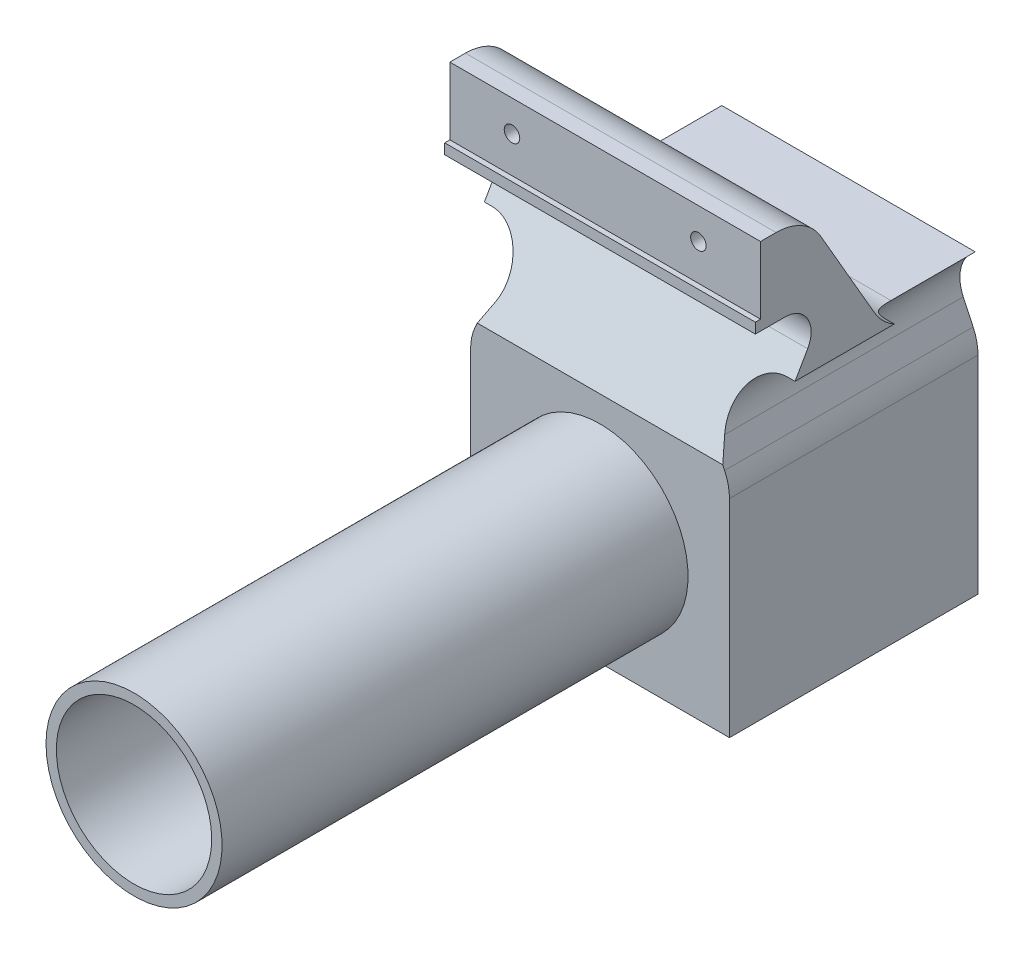
from build123d import *

# Parameters (mm, degrees)
SKETCH2_R               = 2.5
SKETCH2_R_2             = 8
BOSS_EXTRUDE1_DEPTH     = 48
CUT_EXTRUDE1_DEPTH      = 103.122475489
CUT_EXTRUDE1_DEPTH_BACK = 103.122475489
SKETCH3_W               = 1
SKETCH3_H               = 13
CUT_EXTRUDE2_DEPTH      = 103.122475489
CUT_EXTRUDE2_DEPTH_BACK = 103.122475489
SKETCH4_R               = 1.5
CUT_EXTRUDE3_DEPTH      = 5
CUT_EXTRUDE4_START      = -48
SKETCH2_4_R             = 2.5
CUT_EXTRUDE4_DEPTH      = 5
SKETCH6_R               = 17
SKETCH6_R_2             = 15
BOSS_EXTRUDE2_DEPTH     = 90
CUT_EXTRUDE6_START      = -38
SKETCH7_R               = 15
CUT_EXTRUDE6_DEPTH      = 38
CUT_EXTRUDE7_REACH      = 129.377
SKETCH8_R               = 15


with BuildPart() as part:
    # Sketch2 → Boss-Extrude1 (new body)
    # profile 1 of 3: a face of its own
    with BuildSketch(Plane.XY):
        with BuildLine():
            Line((25, 0), (25, 40))
            ThreePointArc((25, 40), (24.762960071, 42.164396139), (24.06307787, 44.226182617))
            Line((24.06307787, 44.226182617), (22.155845491, 48.316255655))
            ThreePointArc((22.155845491, 48.316255655), (22.596259879, 55.035680745), (28.5, 58.274583487))
            Line((28.5, 58.274583487), (30, 58.274583487))
            Line((30, 58.274583487), (30, 85))
            Line((30, 85), (-30, 85))
            Line((-30, 85), (-30, 58.274583487))
            Line((-30, 58.274583487), (-28.5, 58.274583487))
            ThreePointArc((-28.5, 58.274583487), (-22.596259879, 55.035680745), (-22.155845491, 48.316255655))
            Line((-22.155845491, 48.316255655), (-24.06307787, 44.226182617))
            ThreePointArc((-24.06307787, 44.226182617), (-24.762960071, 42.164396139), (-25, 40))
            Line((-25, 40), (-25, 0))
            Line((-25, 0), (25, 0))
        make_face()
        with Locations((15, 23)):
            Circle(SKETCH2_R, mode=Mode.SUBTRACT)
        with Locations((-15, 23)):
            Circle(SKETCH2_R, mode=Mode.SUBTRACT)
        with Locations((0, 23)):
            Circle(SKETCH2_R_2, mode=Mode.SUBTRACT)
    # profile 2 of 3: a face of its own
    with BuildSketch(Plane.XY):
        with Locations((15, 23)):
            Circle(SKETCH2_R)
    # profile 3 of 3: a face of its own
    with BuildSketch(Plane.XY):
        with Locations((-15, 23)):
            Circle(SKETCH2_R)
    extrude(amount=-BOSS_EXTRUDE1_DEPTH)

    # Sketch3 → Cut-Extrude1 (cut, two sides: drawn at the far end of the back side and taken through both)
    with BuildSketch(Plane(origin=(0, 0, 0), x_dir=(0, 0, -1), z_dir=(1, 0, 0)).offset(-CUT_EXTRUDE1_DEPTH_BACK)):
        with Locations((0.5, 78.5)):
            Rectangle(SKETCH3_W, SKETCH3_H)
    extrude(amount=CUT_EXTRUDE1_DEPTH + CUT_EXTRUDE1_DEPTH_BACK, mode=Mode.SUBTRACT)

    # Sketch3<3> → Cut-Extrude2 (cut, two sides: drawn at the far end of the back side and taken through both)
    with BuildSketch(Plane(origin=(0, 0, 0), x_dir=(0, 0, -1), z_dir=(1, 0, 0)).offset(-CUT_EXTRUDE2_DEPTH_BACK)):
        with BuildLine():
            ThreePointArc((12.660254038, 80), (9, 83.660254038), (4, 85))
            Line((4, 85), (48, 85))
            Line((48, 85), (48, 57))
            Line((48, 57), (31.712812921, 57))
            ThreePointArc((31.712812921, 57), (26.712812921, 58.339745962), (23.052558883, 62))
            Line((23.052558883, 62), (12.660254038, 80))
        make_face()
        with BuildLine():
            ThreePointArc((5.773502692, 70), (10.103629711, 67.5), (10.103629711, 62.5))
            Line((10.103629711, 62.5), (0, 45))
            Line((0, 45), (0, 70))
            Line((0, 70), (5.773502692, 70))
        make_face()
    extrude(amount=CUT_EXTRUDE2_DEPTH + CUT_EXTRUDE2_DEPTH_BACK, mode=Mode.SUBTRACT)

    # Sketch4 → Cut-Extrude3 (cut)
    with BuildSketch(Plane.XY.offset(-1)):
        with Locations((-18, 79)):
            Circle(SKETCH4_R)
        with Locations((18, 79)):
            Circle(SKETCH4_R)
    extrude(amount=-CUT_EXTRUDE3_DEPTH, mode=Mode.SUBTRACT)

    # Sketch2<4> → Cut-Extrude4 (cut)
    with BuildSketch(Plane.XY.offset(CUT_EXTRUDE4_START)):
        with Locations((-15, 23)):
            Circle(SKETCH2_4_R)
        with Locations((15, 23)):
            Circle(SKETCH2_4_R)
    extrude(amount=CUT_EXTRUDE4_DEPTH, mode=Mode.SUBTRACT)

    # Sketch6 → Boss-Extrude2 (add)
    with BuildSketch(Plane.XY):
        with Locations(Location((0, 23, 0), (0, 0, 180))):
            Circle(SKETCH6_R)
        with Locations(Location((0, 23, 0), (0, 0, 180))):
            Circle(SKETCH6_R_2, mode=Mode.SUBTRACT)
    extrude(amount=BOSS_EXTRUDE2_DEPTH)

    # Sketch7 → Cut-Extrude6 (cut)
    with BuildSketch(Plane.XY.offset(CUT_EXTRUDE6_START)):
        with Locations(Location((0, 23, 0), (0, 0, 180))):
            Circle(SKETCH7_R)
    extrude(amount=CUT_EXTRUDE6_DEPTH, mode=Mode.SUBTRACT)

    # Sketch8 → Cut-Extrude7 (cut, up to next)
    with BuildSketch(Plane.XZ, mode=Mode.PRIVATE) as cut_extrude7_sk1:
        with Locations(Location((0, -24, 0), (0, 0, 270))):
            Circle(SKETCH8_R)
    cut_extrude7_tool1 = extrude(cut_extrude7_sk1.sketch, amount=-CUT_EXTRUDE7_REACH, mode=Mode.PRIVATE) & part.part
    add(cut_extrude7_tool1.solids().sort_by_distance((0, 0, -24))[0], mode=Mode.SUBTRACT)


solid = part.part
